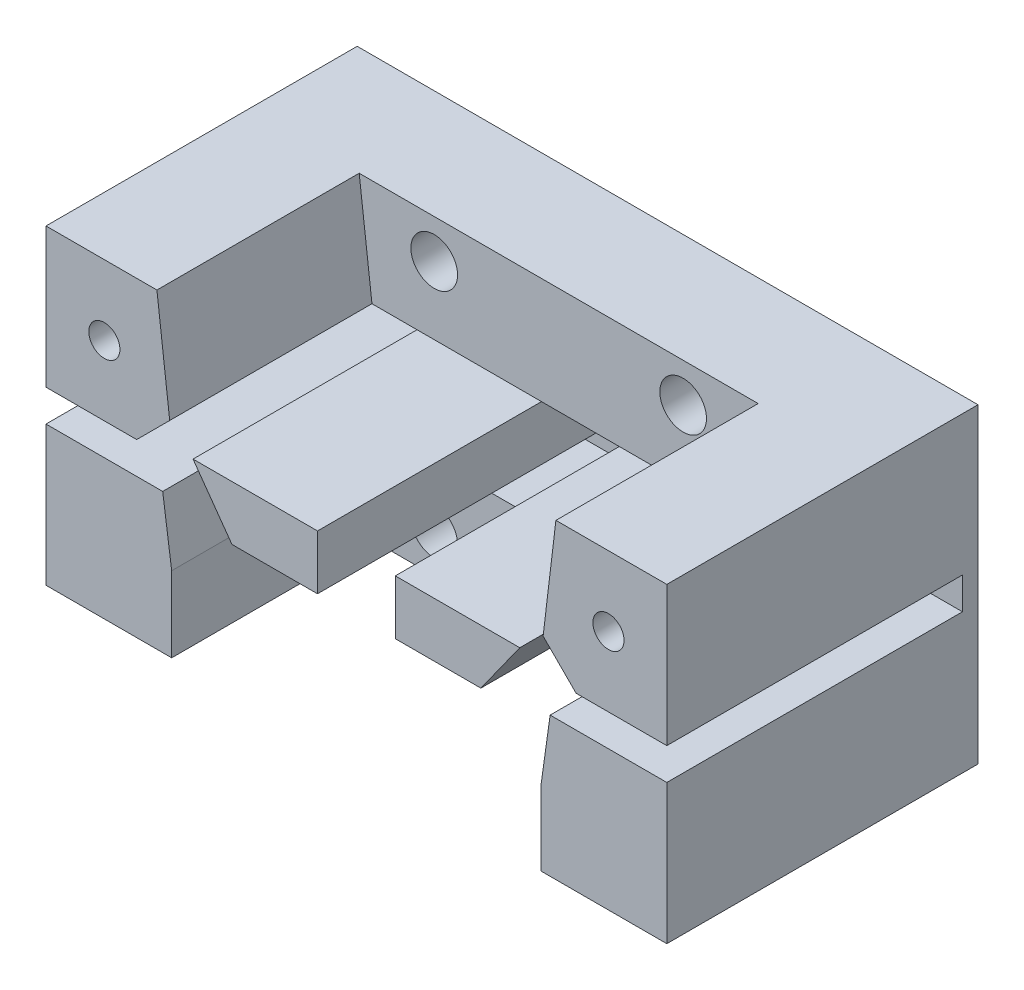
from build123d import *

# Parameters (mm, degrees)
SKETCH_1_W           = 39.9
SKETCH_1_H           = 20
EXTRUDE_1_DEPTH      = 1
EXTRUDE_4_DEPTH      = 19
CUT_EXTRUDE_1_DEPTH  = 13
F_3_0MM_3_AT_2_COUNT = 2
F_3_0MM_3_AT_2_PITCH = 12
EXTRUDE_5_DEPTH      = 13
CUT_EXTRUDE_2_DEPTH  = 13
SKETCH_27_R          = 1
CUT_EXTRUDE_3_DEPTH  = 6
SKETCH_28_R          = 1.5
CUT_EXTRUDE_4_DEPTH  = 26.82639154


with BuildPart() as part:
    # 草图1 → 凸台-拉伸1 (new body)
    with BuildSketch(Plane.XY):
        Rectangle(SKETCH_1_W, SKETCH_1_H)
    extrude(amount=EXTRUDE_1_DEPTH)

    # 草图2 → 凸台-拉伸4 (add)
    with BuildSketch(Plane.XY.offset(1)):
        Polygon((-19.95, 10), (-19.95, 1.025), (-14.121320344, 1.025), (-12, 3.146320344), (0, 3.146320344), (0, 10), align=None)
        Polygon((19.95, 10), (0, 10), (0, 3.146320344), (12, 3.146320344), (14.121320344, 1.025), (19.95, 1.025), align=None)
        Polygon((-8, -1.75), (-10.5, 1.75), (-2.5, 1.75), (-2.5, -1.75), align=None)
        Polygon((2.5, -1.75), (2.5, 1.75), (10.5, 1.75), (8, -1.75), align=None)
        Polygon((-12.45, -1.025), (-19.95, -1.025), (-19.95, -10), (19.95, -10), (19.95, -1.025), (12.45, -1.025), (10.646428571, -3.55), (-10.646428571, -3.55), align=None)
    extrude(amount=EXTRUDE_4_DEPTH)

    # 草图4 → 切除-拉伸1 (cut)
    with BuildSketch(Plane.XY.offset(20)):
        Polygon((-12.45, -1.025), (-11.193517665, -10), (0, -13.387486255), (11.193517665, -10), (12.45, -1.025), (10.646428571, -3.55), (-10.646428571, -3.55), align=None)
        Polygon((-14.121320344, 1.025), (-12.45, 12.563933046), (12.45, 12.563933046), (14.121320344, 1.025), (12, 3.146320344), (-12, 3.146320344), align=None)
    extrude(amount=-CUT_EXTRUDE_1_DEPTH, mode=Mode.SUBTRACT)

    # 草图22 → Ø3.0mm 暗销孔3 (revolve, cut)
    with BuildSketch(Plane(origin=(-15.5, -10, 16), x_dir=(0, 0, -1), z_dir=(1, 0, 0))):
        Polygon((0, 0), (0, 6.901290929), (1.5, 6), (1.5, 0), align=None)
    f_3_0mm_3 = revolve(axis=Axis((-15.5, -16.35, 16), (0, 1, 0)), mode=Mode.SUBTRACT)

    # Ø3.0mm 暗销孔3 at 2: Ø3.0mm 暗销孔3 ×2
    with Locations(*[(0, 0, -i * F_3_0MM_3_AT_2_PITCH) for i in range(1, F_3_0MM_3_AT_2_COUNT)]):
        add(f_3_0mm_3, mode=Mode.SUBTRACT)

    # 镜向3: Ø3.0mm 暗销孔3 across plane
    add(f_3_0mm_3.mirror(Plane(origin=(0, 0, 0), x_dir=(0, 0, 1), z_dir=(1, 0, 0))), mode=Mode.SUBTRACT)

    # 镜向3 copy 1 sketch → 镜向3 copy 1 (revolve, cut)
    with BuildSketch(Plane(origin=(15.5, -10, 4), x_dir=(0, 0, -1), z_dir=(-1, 0, 0))):
        Polygon((0, 0), (0, -6.901290929), (1.5, -6), (1.5, 0), align=None)
    revolve(axis=Axis((15.5, -16.35, 4), (0, -1, 0)), mode=Mode.SUBTRACT)

    # 草图25 → 凸台-拉伸5 (add)
    with BuildSketch(Plane.XY.offset(7)):
        Polygon((-12.821364791, 10), (-12, 3.146320344), (-14.121320344, 1.025), align=None)
        Polygon((12, 3.146320344), (14.121320344, 1.025), (12.821364791, 10), align=None)
    extrude(amount=EXTRUDE_5_DEPTH)

    # 草图26 → 切除-拉伸2 (cut)
    with BuildSketch(Plane.XY.offset(20)):
        Polygon((-11.872508119, -5.15), (-11.872508119, -10), (-11.193517665, -10), align=None)
        Polygon((11.193517665, -10), (11.872508119, -5.15), (11.872508119, -10), align=None)
    extrude(amount=-CUT_EXTRUDE_2_DEPTH, mode=Mode.SUBTRACT)

    # 草图27 → 切除-拉伸3 (cut)
    with BuildSketch(Plane.XY.offset(20)):
        with Locations((-16.2, 5.5)):
            Circle(SKETCH_27_R)
        with Locations(Location((16.2, 5.5, 0), (0, 0, 180))):
            Circle(SKETCH_27_R)
    extrude(amount=-CUT_EXTRUDE_3_DEPTH, mode=Mode.SUBTRACT)

    # 草图28 → 切除-拉伸4 (cut, through all)
    with BuildSketch(Plane.XY.offset(7)):
        with Locations((-8, 7.5)):
            Circle(SKETCH_28_R)
        with Locations((-8, -7.5)):
            Circle(SKETCH_28_R)
        with Locations(Location((8, -7.5, 0), (0, 0, 180))):
            Circle(SKETCH_28_R)
        with Locations(Location((8, 7.5, 0), (0, 0, 180))):
            Circle(SKETCH_28_R)
    extrude(amount=-CUT_EXTRUDE_4_DEPTH, mode=Mode.SUBTRACT)


solid = part.part
